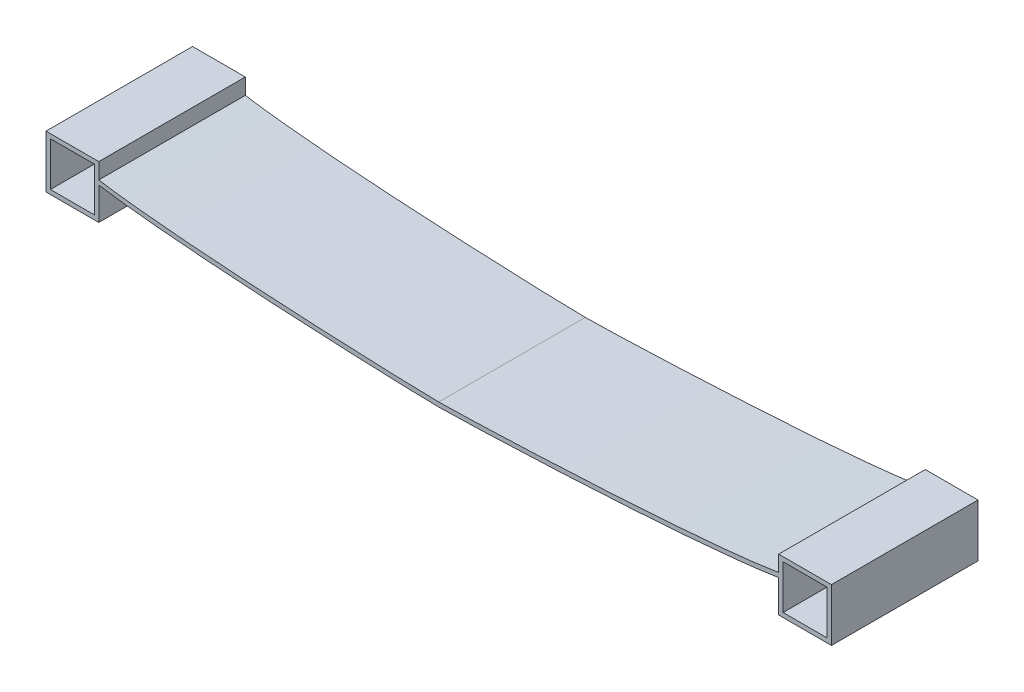
from build123d import *

# Parameters (mm, degrees)
SKETCH_1_W      = 30
SKETCH_1_H      = 30
EXTRUDE_1_DEPTH = 100


with BuildPart() as part:
    # 草图1 → 凸台-拉伸1 (new body)
    with BuildSketch(Plane.XY):
        with BuildLine():
            Line((-144.182585402, 132.939080083), (-144.182585402, 110.814974878))
            Line((-144.182585402, 110.814974878), (-180.182585402, 110.814974878))
            Line((-180.182585402, 110.814974878), (-180.182585402, 146.814974878))
            Line((-180.182585402, 146.814974878), (-144.182585402, 146.814974878))
            Line((-144.182585402, 146.814974878), (-144.182585402, 135.93327271))
            add(Edge.make_bspline(
                [(-144.182585402, 135.93327271), (-84.006194356, 126.149155878), (67.52504744, 120.723650806), (87.817414598, 120.723650806)],
                knots=[0, 0, 0, 0, 1, 1, 1, 1], degree=3))
            add(Edge.make_bspline(
                [(319.817414598, 135.93327271), (259.641023552, 126.149155878), (108.109781755, 120.723650806), (87.817414598, 120.723650806)],
                knots=[0, 0, 0, 0, 1, 1, 1, 1], degree=3))
            Line((319.817414598, 135.93327271), (319.817414598, 146.814974878))
            Line((319.817414598, 146.814974878), (355.817414598, 146.814974878))
            Line((355.817414598, 146.814974878), (355.817414598, 110.814974878))
            Line((355.817414598, 110.814974878), (319.817414598, 110.814974878))
            Line((319.817414598, 110.814974878), (319.817414598, 132.939080083))
            add(Edge.make_bspline(
                [(319.817414598, 132.939080083), (258.989502419, 123.151302777), (108.481742181, 117.723650806), (87.817414598, 117.723650806)],
                knots=[0, 0, 0, 0, 1, 1, 1, 1], degree=3))
            add(Edge.make_bspline(
                [(-144.182585402, 132.939080083), (-83.354673224, 123.151302777), (67.153087014, 117.723650806), (87.817414598, 117.723650806)],
                knots=[0, 0, 0, 0, 1, 1, 1, 1], degree=3))
        make_face()
        with Locations((-162.182585402, 128.814974878)):
            Rectangle(SKETCH_1_W, SKETCH_1_H, mode=Mode.SUBTRACT)
        with Locations((337.817414598, 128.814974878)):
            Rectangle(SKETCH_1_W, SKETCH_1_H, mode=Mode.SUBTRACT)
    extrude(amount=EXTRUDE_1_DEPTH)


solid = part.part
